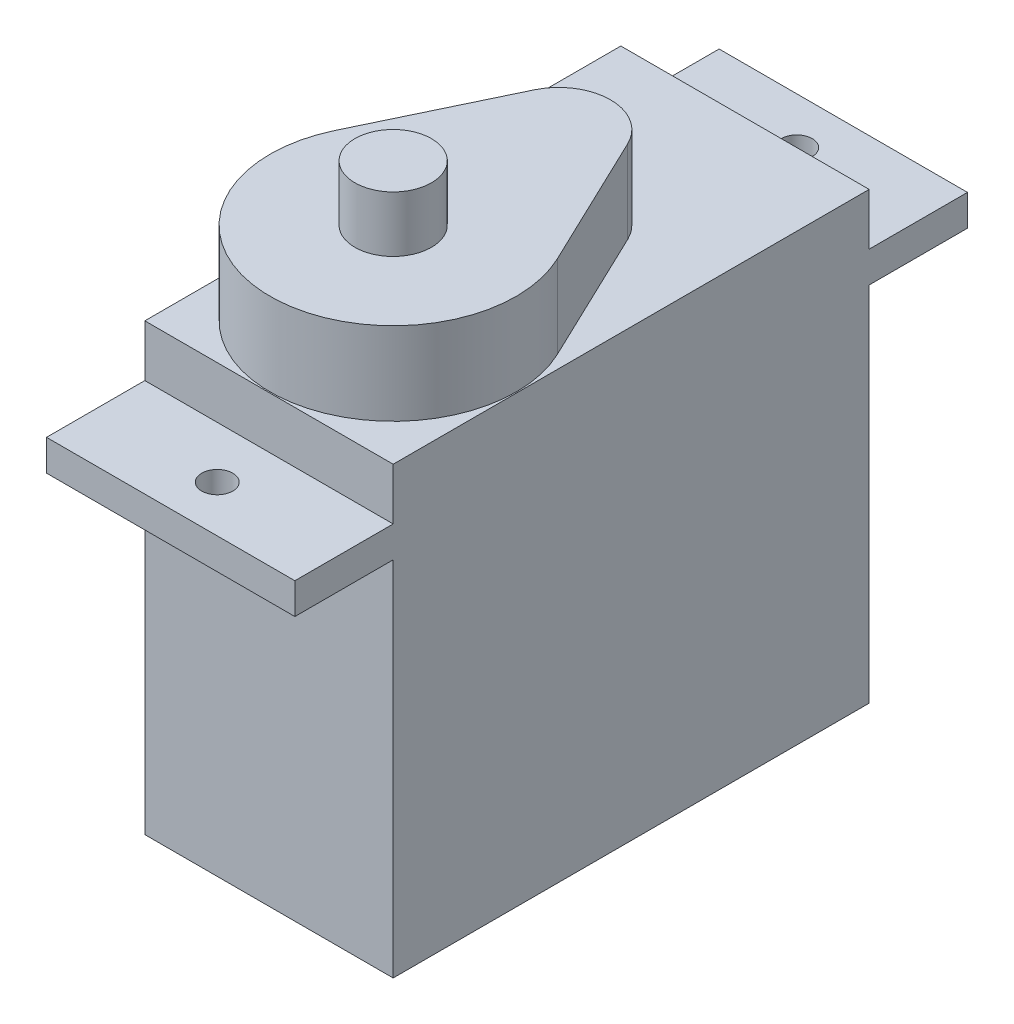
from build123d import *

# Parameters (mm, degrees)
AUFSATZ_LINEAR_AUSTRAGEN1_DEPTH = 12
AUFSATZ_LINEAR_AUSTRAGEN2_DEPTH = 4
SKIZZE3_R                       = 1.85
AUFSATZ_LINEAR_AUSTRAGEN3_DEPTH = 2.7
SKIZZE4_R                       = 0.75
SCHNITT_LINEAR_AUSTRAGEN1_DEPTH = 36.708017307


with BuildPart() as part:
    # Skizze1 → Aufsatz-Linear austragen1 (new body)
    with BuildSketch(Plane(origin=(0, 0, 0), x_dir=(0, 0, -1), z_dir=(1, 0, 0))):
        Polygon((0, 0), (23, 0), (23, 17.5), (27.75, 17.5), (27.75, 19), (23, 19), (23, 21.5), (0, 21.5), (0, 19), (-4.75, 19), (-4.75, 17.5), (0, 17.5), align=None)
    extrude(amount=AUFSATZ_LINEAR_AUSTRAGEN1_DEPTH)

    # Skizze2 → Aufsatz-Linear austragen2 (add)
    with BuildSketch(Plane(origin=(0, 21.5, 0), x_dir=(1, 0, 0), z_dir=(0, 1, 0))):
        with BuildLine():
            Line((3.744418815, 15.078125), (0.631716779, 8.5659375))
            ThreePointArc((0.631716779, 8.5659375), (6, 0.05), (11.368283221, 8.5659375))
            Line((11.368283221, 8.5659375), (8.255581185, 15.078125))
            ThreePointArc((8.255581185, 15.078125), (6, 16.5), (3.744418815, 15.078125))
        make_face()
    extrude(amount=AUFSATZ_LINEAR_AUSTRAGEN2_DEPTH)

    # Skizze3 → Aufsatz-Linear austragen3 (add)
    with BuildSketch(Plane(origin=(0, 25.5, 0), x_dir=(1, 0, 0), z_dir=(0, 1, 0))):
        with Locations(Location((6, 6, 0), (0, 0, 90))):
            Circle(SKIZZE3_R)
    extrude(amount=AUFSATZ_LINEAR_AUSTRAGEN3_DEPTH)

    # Skizze4 → Schnitt-Linear austragen1 (cut, through all)
    with BuildSketch(Plane(origin=(0, 19, 0), x_dir=(1, 0, 0), z_dir=(0, 1, 0))):
        with Locations(Location((6, -2.5, 0), (0, 0, 270))):
            Circle(SKIZZE4_R)
        with Locations(Location((6, 25.5, 0), (0, 0, 270))):
            Circle(SKIZZE4_R)
    extrude(amount=-SCHNITT_LINEAR_AUSTRAGEN1_DEPTH, mode=Mode.SUBTRACT)


solid = part.part
